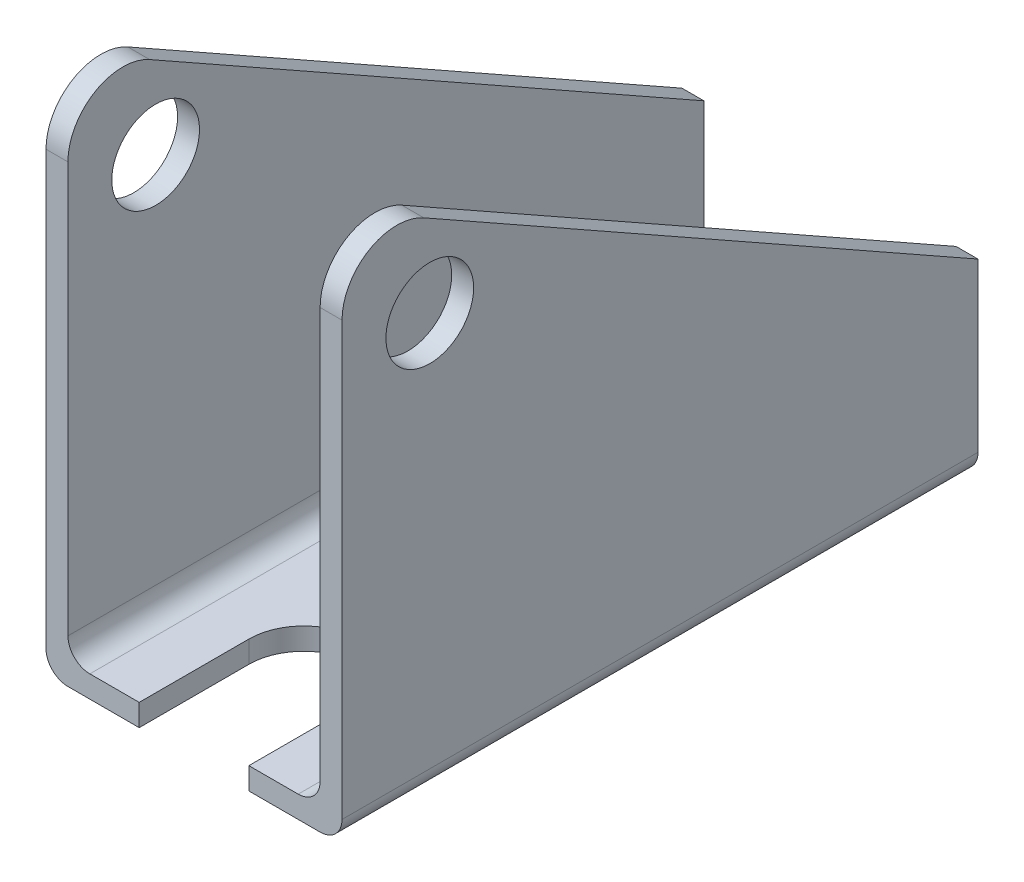
from build123d import *

# Parameters (mm, degrees)
SKETCH1_W           = 27
SKETCH1_H           = 58
BOSS_EXTRUDE1_DEPTH = 2
BOSS_EXTRUDE2_DEPTH = 58
CUT_EXTRUDE1_DEPTH  = 58
SKETCH4_R           = 4
CUT_EXTRUDE2_DEPTH  = 58
CUT_EXTRUDE3_DEPTH  = 58
CUT_EXTRUDE4_DEPTH  = 58
SKETCH7_R           = 5
CUT_EXTRUDE5_DEPTH  = 58


with BuildPart() as part:
    # Sketch1 → Boss-Extrude1 (new body)
    with BuildSketch(Plane(origin=(0, 0, 0), x_dir=(1, 0, 0), z_dir=(0, 1, 0))):
        Rectangle(SKETCH1_W, SKETCH1_H)
    extrude(amount=BOSS_EXTRUDE1_DEPTH)

    # Sketch2 → Boss-Extrude2 (add)
    with BuildSketch(Plane.XY.offset(29)):
        with BuildLine():
            Line((-13.5, 2), (-13.5, 50))
            Line((-13.5, 50), (-11.5, 50))
            Line((-11.5, 50), (-11.5, 4))
            ThreePointArc((-11.5, 4), (-10.914213562, 2.585786438), (-9.5, 2))
            Line((-9.5, 2), (9.5, 2))
            ThreePointArc((9.5, 2), (10.914213562, 2.585786438), (11.5, 4))
            Line((11.5, 4), (11.5, 50))
            Line((11.5, 50), (13.5, 50))
            Line((13.5, 50), (13.5, 2))
            ThreePointArc((13.5, 2), (12.914213562, 0.585786438), (11.5, 0))
            Line((11.5, 0), (-11.5, 0))
            ThreePointArc((-11.5, 0), (-12.914213562, 0.585786438), (-13.5, 2))
        make_face()
    extrude(amount=-BOSS_EXTRUDE2_DEPTH)

    # Sketch3 → Cut-Extrude1 (cut)
    with BuildSketch(Plane(origin=(13.5, 0, 0), x_dir=(0, 0, -1), z_dir=(1, 0, 0))):
        Polygon((29, 17.261652863), (-29, 50), (29, 50), align=None)
    extrude(amount=-CUT_EXTRUDE1_DEPTH, mode=Mode.SUBTRACT)

    # Sketch4 → Cut-Extrude2 (cut)
    with BuildSketch(Plane(origin=(13.5, 0, 0), x_dir=(0, 0, -1), z_dir=(1, 0, 0))):
        with Locations((-21, 38)):
            Circle(SKETCH4_R)
    extrude(amount=-CUT_EXTRUDE2_DEPTH, mode=Mode.SUBTRACT)

    # Sketch5 → Cut-Extrude3 (cut)
    with BuildSketch(Plane(origin=(13.5, 0, 0), x_dir=(0, 0, -1), z_dir=(1, 0, 0))):
        with BuildLine():
            Line((-29, 41.436194465), (-29, 50))
            Line((-29, 50), (-21.542232449, 45.790431328))
            ThreePointArc((-21.542232449, 45.790431328), (-26.521027791, 45.754112815), (-29, 41.436194465))
        make_face()
    extrude(amount=-CUT_EXTRUDE3_DEPTH, mode=Mode.SUBTRACT)

    # Sketch6 → Cut-Extrude4 (cut)
    with BuildSketch(Plane.XY.offset(29)):
        with BuildLine():
            Line((-13.5, 0), (-11.5, 0))
            ThreePointArc((-11.5, 0), (-12.914213562, 0.585786438), (-13.5, 2))
            Line((-13.5, 2), (-13.5, 0))
        make_face()
        with BuildLine():
            Line((13.5, 2), (13.5, 0))
            Line((13.5, 0), (11.5, 0))
            ThreePointArc((11.5, 0), (12.914213562, 0.585786438), (13.5, 2))
        make_face()
    extrude(amount=-CUT_EXTRUDE4_DEPTH, mode=Mode.SUBTRACT)

    # Sketch7 → Cut-Extrude5 (cut)
    with BuildSketch(Plane.XZ):
        with Locations(Location((0, -11, 0), (0, 0, 270))):
            Circle(SKETCH7_R)
        with BuildLine():
            Line((-5, 19), (-5, 29))
            Line((-5, 29), (5, 29))
            Line((5, 29), (5, 19))
            ThreePointArc((5, 19), (0, 14), (-5, 19))
        make_face()
    extrude(amount=-CUT_EXTRUDE5_DEPTH, mode=Mode.SUBTRACT)


solid = part.part
